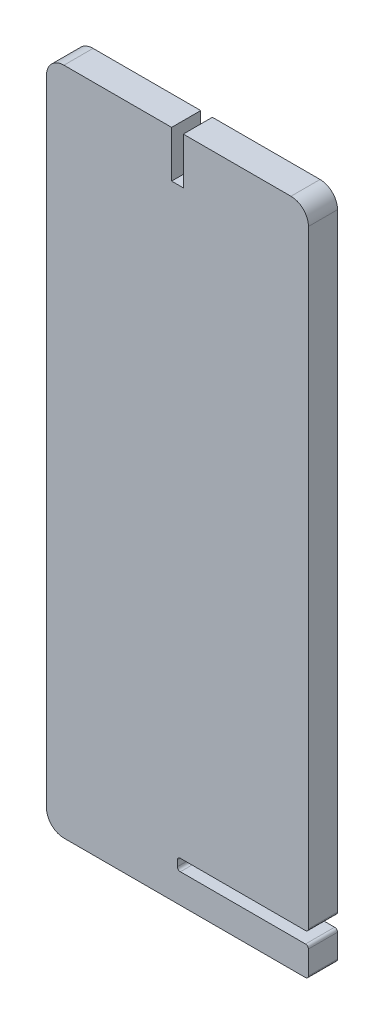
from build123d import *

# Parameters (mm, degrees)
CROQUIS1_W              = 45
CROQUIS1_H              = 115
SALIENTE_EXTRUIR1_DEPTH = 5
CROQUIS3_W              = 22.5
CROQUIS3_H              = 2
CORTAR_EXTRUIR2_DEPTH   = 5
REDONDEO1_R             = 3
CROQUIS4_W              = 2
CROQUIS4_H              = 8
CORTAR_EXTRUIR3_DEPTH   = 5
REDONDEO2_R             = 0.5


with BuildPart() as part:
    # Croquis1 → Saliente-Extruir1 (new body)
    with BuildSketch(Plane.XY):
        with Locations((0, -12.5)):
            Rectangle(CROQUIS1_W, CROQUIS1_H)
    extrude(amount=SALIENTE_EXTRUIR1_DEPTH)

    # Croquis3 → Cortar-Extruir2 (cut)
    with BuildSketch(Plane.XY.offset(5)):
        with Locations((11.25, -64)):
            Rectangle(CROQUIS3_W, CROQUIS3_H)
    extrude(amount=-CORTAR_EXTRUIR2_DEPTH, mode=Mode.SUBTRACT)

    # Redondeo1
    redondeo1_edges = [part.edges().sort_by_distance(p)[0] for p in [
        (-22.5, 45, 2.5),
        (-22.5, -70, 2.5),
        (22.5, 45, 2.5),
    ]]
    fillet(redondeo1_edges, radius=REDONDEO1_R)

    # Croquis4 → Cortar-Extruir3 (cut)
    with BuildSketch(Plane.XY.offset(5)):
        with Locations((0, 41)):
            Rectangle(CROQUIS4_W, CROQUIS4_H)
    extrude(amount=-CORTAR_EXTRUIR3_DEPTH, mode=Mode.SUBTRACT)

    # Redondeo2
    redondeo2_edges = [part.edges().sort_by_distance(p)[0] for p in [
        (0, -63, 2.5),
        (0, -65, 2.5),
        (22.5, -65, 2.5),
        (22.5, -63, 2.5),
        (22.5, -70, 2.5),
    ]]
    fillet(redondeo2_edges, radius=REDONDEO2_R)


solid = part.part
